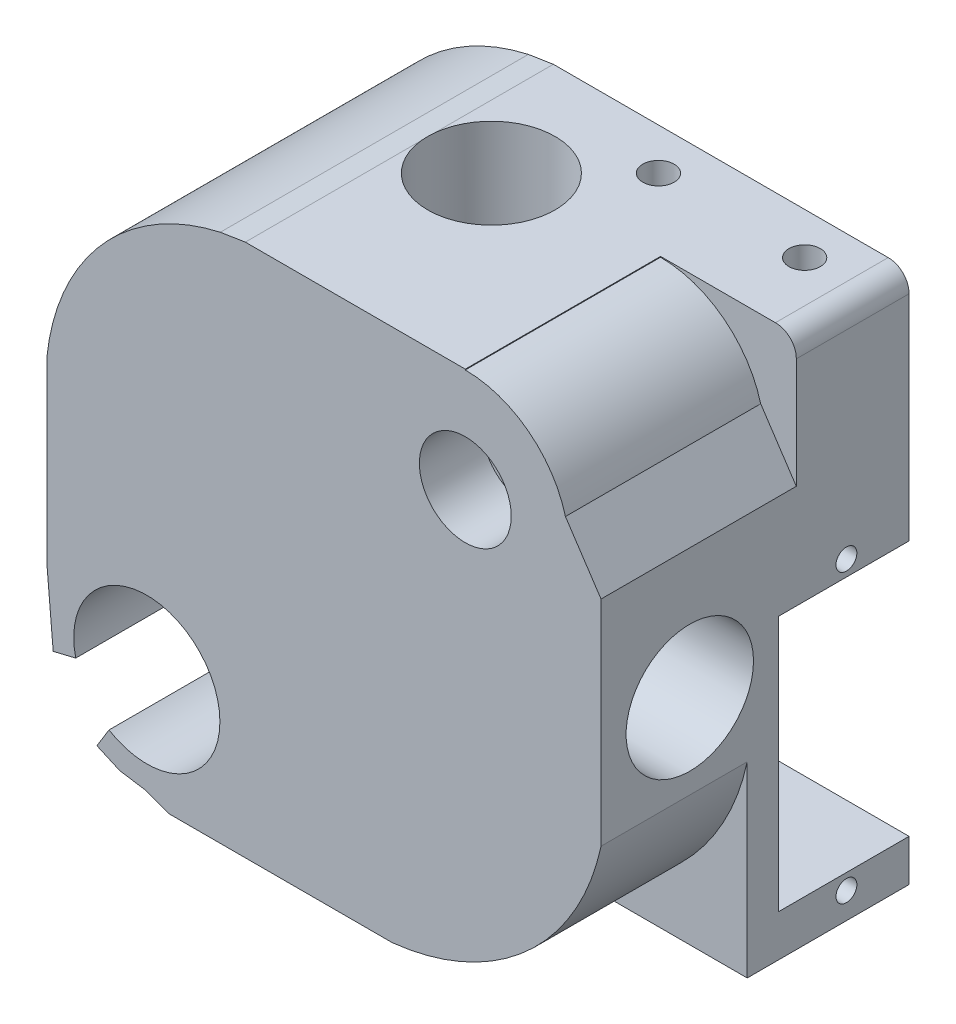
from build123d import *

# Parameters (mm, degrees)
SALIENTE_EXTRUIR1_DEPTH = 29.5
CORTAR_EXTRUIR11_DEPTH  = 18.7
CROQUIS12_W             = 20
CROQUIS12_H             = 28.5
SALIENTE_EXTRUIR2_DEPTH = 15.5
CROQUIS6_R              = 8.5
CORTAR_EXTRUIR1_DEPTH   = 10
CROQUIS7_R              = 4.1
CORTAR_EXTRUIR2_DEPTH   = 13.5
CROQUIS8_R              = 4.4
CORTAR_EXTRUIR3_DEPTH   = 6
CROQUIS2_R              = 6.1
CORTAR_EXTRUIR4_DEPTH   = 20
CORTAR_EXTRUIR5_START   = -20
CROQUIS3_R              = 6.1
CORTAR_EXTRUIR5_DEPTH   = 20
CROQUIS4_R              = 6.1
CORTAR_EXTRUIR6_DEPTH   = 20
CORTAR_EXTRUIR7_START   = -20
CROQUIS5_R              = 6.1
CORTAR_EXTRUIR7_DEPTH   = 20
CORTAR_EXTRUIR8_REACH   = 72.631
CROQUIS9_R              = 3.5
CORTAR_EXTRUIR9_REACH   = 74.107
CROQUIS10_R             = 3.5
CROQUIS13_W             = 20
CROQUIS13_H             = 24.5
CORTAR_EXTRUIR10_DEPTH  = 12.5
CORTAR_EXTRUIR12_START  = -10
CROQUIS18_R             = 1.5
CORTAR_EXTRUIR12_DEPTH  = 10
CROQUIS19_R             = 1
CORTAR_EXTRUIR13_DEPTH  = 10
CROQUIS20_R             = 2.1
CORTAR_EXTRUIR14_DEPTH  = 10


with BuildPart() as part:
    # Croquis1 → Saliente-Extruir1 (new body)
    with BuildSketch(Plane.XY):
        with BuildLine():
            Line((5.532260486, 11.858052865), (4.932758535, 18.779017183))
            Line((4.932758535, 18.779017183), (4.932758535, 36))
            ThreePointArc((4.932758535, 36), (10.243586381, 47.979347327), (21.538526154, 54.62268913))
            Line((21.538526154, 54.62268913), (23.932758535, 55))
            Line((23.932758535, 55), (56, 55))
            ThreePointArc((56, 55), (57.424264069, 54.424264069), (58, 53))
            Line((58, 53), (58, 21.932758535))
            ThreePointArc((58, 21.932758535), (50.913097547, 9.695983483), (38, 3.932758535))
            Line((38, 3.932758535), (16.641947135, 3.932758535))
            Line((16.641947135, 3.932758535), (14.26534365, 4.78116089))
            Line((14.26534365, 4.78116089), (11.904731608, 5.153727551))
            Line((11.904731608, 5.153727551), (9.720982817, 6.124570664))
            Line((9.720982817, 6.124570664), (10.875746205, 8.011278565))
            ThreePointArc((10.875746205, 8.011278565), (20.155175368, 18.125408047), (7.690637501, 12.377476547))
            Line((7.690637501, 12.377476547), (5.532260486, 11.858052865))
        make_face()
    extrude(amount=-SALIENTE_EXTRUIR1_DEPTH)

    # Croquis15 → Cortar-Extruir11 (cut)
    with BuildSketch(Plane.XY):
        with BuildLine():
            Line((58, 42.430465887), (58, 53))
            ThreePointArc((58, 53), (57.424264069, 54.424264069), (56, 55))
            Line((56, 55), (45, 55))
            Line((45, 55), (45, 54.927917446))
            ThreePointArc((45, 54.927917446), (51.043733212, 52.876346468), (54.589631863, 47.569534113))
            Line((54.589631863, 47.569534113), (58, 42.430465887))
        make_face()
    extrude(amount=-CORTAR_EXTRUIR11_DEPTH, mode=Mode.SUBTRACT)

    # Croquis12 → Saliente-Extruir2 (add)
    with BuildSketch(Plane(origin=(0, 0, -29.5), x_dir=(-1, 0, 0), z_dir=(0, 0, -1))):
        with Locations((-48, 18.25)):
            Rectangle(CROQUIS12_W, CROQUIS12_H)
    extrude(amount=-SALIENTE_EXTRUIR2_DEPTH)

    # Croquis6 → Cortar-Extruir1 (cut)
    with BuildSketch(Plane(origin=(0, 0, -29.5), x_dir=(-1, 0, 0), z_dir=(0, 0, -1))):
        with Locations((-45, 45)):
            Circle(CROQUIS6_R)
    extrude(amount=-CORTAR_EXTRUIR1_DEPTH, mode=Mode.SUBTRACT)

    # Croquis7 → Cortar-Extruir2 (cut)
    with BuildSketch(Plane(origin=(0, 0, -19.5), x_dir=(-1, 0, 0), z_dir=(0, 0, -1))):
        with Locations((-45, 45)):
            Circle(CROQUIS7_R)
    extrude(amount=-CORTAR_EXTRUIR2_DEPTH, mode=Mode.SUBTRACT)

    # Croquis8 → Cortar-Extruir3 (cut)
    with BuildSketch(Plane.XY):
        with Locations((45, 45)):
            Circle(CROQUIS8_R)
    extrude(amount=-CORTAR_EXTRUIR3_DEPTH, mode=Mode.SUBTRACT)

    # Croquis2 → Cortar-Extruir4 (cut)
    with BuildSketch(Plane.XZ.offset(-3.932758535)):
        with Locations((30, -17.5)):
            Circle(CROQUIS2_R)
    extrude(amount=-CORTAR_EXTRUIR4_DEPTH, mode=Mode.SUBTRACT)

    # Croquis3 → Cortar-Extruir5 (cut)
    with BuildSketch(Plane(origin=(0, 55, 0), x_dir=(1, 0, 0), z_dir=(0, 1, 0)).offset(CORTAR_EXTRUIR5_START)):
        with Locations((30, 17.5)):
            Circle(CROQUIS3_R)
    extrude(amount=CORTAR_EXTRUIR5_DEPTH, mode=Mode.SUBTRACT)

    # Croquis4 → Cortar-Extruir6 (cut)
    with BuildSketch(Plane.ZY.offset(-4.932758535)):
        with Locations(Location((-8.5, 30, 0), (0, 0, 270))):
            Circle(CROQUIS4_R)
    extrude(amount=-CORTAR_EXTRUIR6_DEPTH, mode=Mode.SUBTRACT)

    # Croquis5 → Cortar-Extruir7 (cut)
    with BuildSketch(Plane(origin=(58, 0, 0), x_dir=(0, 0, -1), z_dir=(1, 0, 0)).offset(CORTAR_EXTRUIR7_START)):
        with Locations(Location((8.5, 30, 0), (0, 0, 270))):
            Circle(CROQUIS5_R)
    extrude(amount=CORTAR_EXTRUIR7_DEPTH, mode=Mode.SUBTRACT)

    # Croquis9 → Cortar-Extruir8 (cut, up to next)
    with BuildSketch(Plane(origin=(38, 0, 0), x_dir=(0, 0, -1), z_dir=(1, 0, 0)), mode=Mode.PRIVATE) as cortar_extruir8_sk1:
        with Locations((8.5, 30)):
            Circle(CROQUIS9_R)
    cortar_extruir8_tool1 = extrude(cortar_extruir8_sk1.sketch, amount=-CORTAR_EXTRUIR8_REACH, mode=Mode.PRIVATE) & part.part
    add(cortar_extruir8_tool1.solids().sort_by_distance((38, 30, -8.5))[0], mode=Mode.SUBTRACT)

    # Croquis10 → Cortar-Extruir9 (cut, up to next)
    with BuildSketch(Plane.XZ.offset(-23.932758535), mode=Mode.PRIVATE) as cortar_extruir9_sk1:
        with Locations((30, -17.5)):
            Circle(CROQUIS10_R)
    cortar_extruir9_tool1 = extrude(cortar_extruir9_sk1.sketch, amount=-CORTAR_EXTRUIR9_REACH, mode=Mode.PRIVATE) & part.part
    add(cortar_extruir9_tool1.solids().sort_by_distance((30, 23.932759, -17.5))[0], mode=Mode.SUBTRACT)

    # Croquis13 → Cortar-Extruir10 (cut)
    with BuildSketch(Plane(origin=(0, 0, -29.5), x_dir=(-1, 0, 0), z_dir=(0, 0, -1))):
        with Locations((-48, 20.25)):
            Rectangle(CROQUIS13_W, CROQUIS13_H)
    extrude(amount=-CORTAR_EXTRUIR10_DEPTH, mode=Mode.SUBTRACT)

    # Croquis18 → Cortar-Extruir12 (cut)
    with BuildSketch(Plane(origin=(0, 55, 0), x_dir=(1, 0, 0), z_dir=(0, 1, 0)).offset(CORTAR_EXTRUIR12_START)):
        with Locations(Location((38.000000773, 25.50000943, 0), (0, 0, 270))):
            Circle(CROQUIS18_R)
        with Locations(Location((52.000000773, 25.50000943, 0), (0, 0, 270))):
            Circle(CROQUIS18_R)
    extrude(amount=CORTAR_EXTRUIR12_DEPTH, mode=Mode.SUBTRACT)

    # Croquis19 → Cortar-Extruir13 (cut)
    with BuildSketch(Plane(origin=(58, 0, 0), x_dir=(0, 0, -1), z_dir=(1, 0, 0))):
        with Locations((23.5, 34)):
            Circle(CROQUIS19_R)
        with Locations((23.5, 6.5)):
            Circle(CROQUIS19_R)
    extrude(amount=-CORTAR_EXTRUIR13_DEPTH, mode=Mode.SUBTRACT)

    # Croquis20 → Cortar-Extruir14 (cut)
    with BuildSketch(Plane(origin=(0, 0, -29.5), x_dir=(-1, 0, 0), z_dir=(0, 0, -1))):
        with Locations((-16, 36)):
            Circle(CROQUIS20_R)
    extrude(amount=-CORTAR_EXTRUIR14_DEPTH, mode=Mode.SUBTRACT)


solid = part.part
